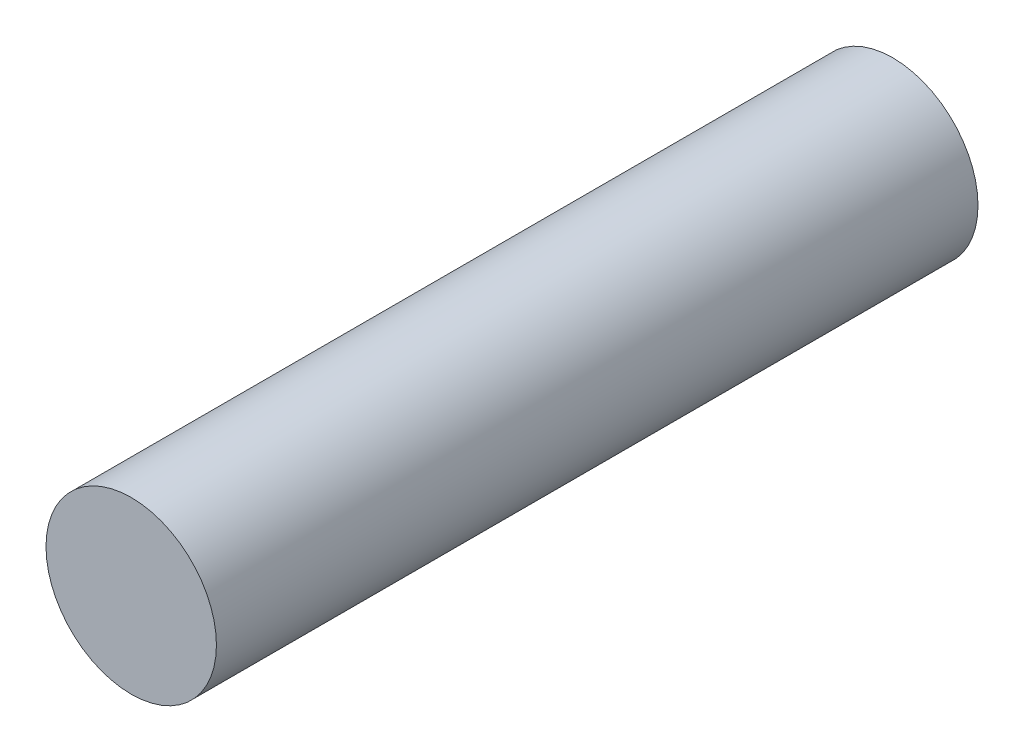
from build123d import *

# Parameters (mm, degrees)
SKETCH1_R           = 2.7
BOSS_EXTRUDE1_DEPTH = 24.13


with BuildPart() as part:
    # Sketch1 → Boss-Extrude1 (new body)
    with BuildSketch(Plane.XY):
        with Locations(Location((0, 0, 0), (0, 0, 180))):
            Circle(SKETCH1_R)
    extrude(amount=BOSS_EXTRUDE1_DEPTH)


solid = part.part
